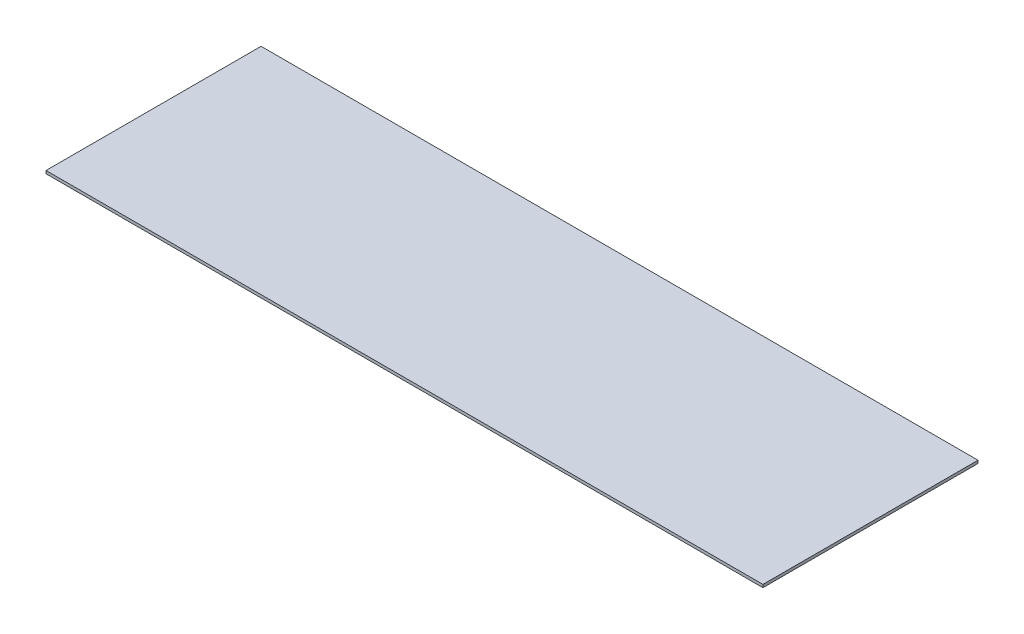
from build123d import *

# Parameters (mm, degrees)
SKIZZE1_W                       = 1000
SKIZZE1_H                       = 4
AUFSATZ_LINEAR_AUSTRAGEN1_DEPTH = 300


with BuildPart() as part:
    # Skizze1 → Aufsatz-Linear austragen1 (new body)
    with BuildSketch(Plane.XY):
        with Locations((0, 2)):
            Rectangle(SKIZZE1_W, SKIZZE1_H)
    extrude(amount=AUFSATZ_LINEAR_AUSTRAGEN1_DEPTH)


solid = part.part
